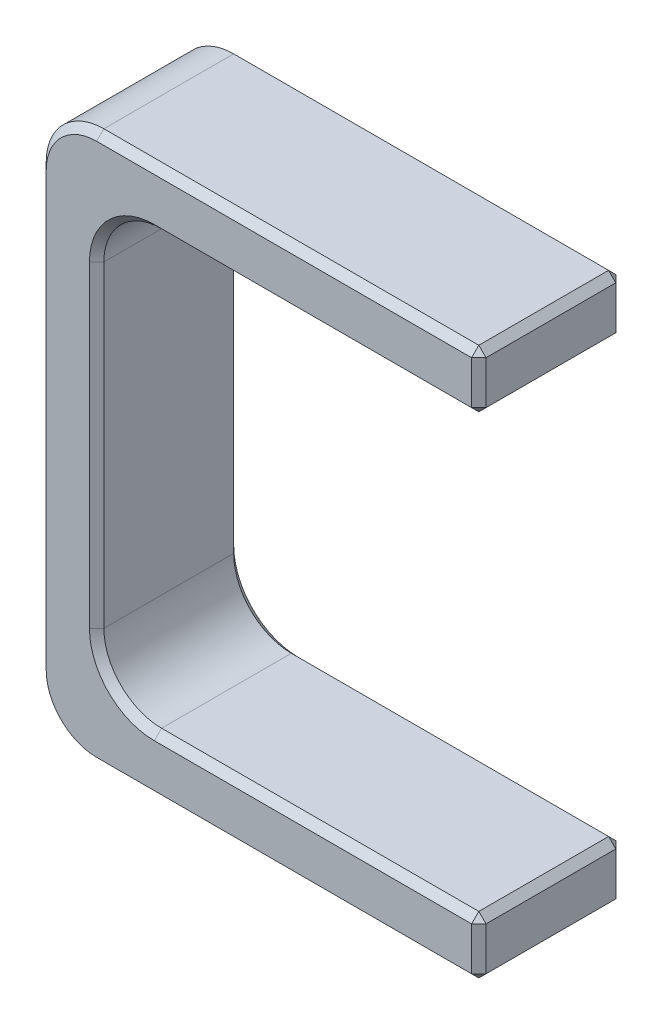
from build123d import *

# Parameters (mm, degrees)
BOSS_EXTRUDE1_DEPTH = 10
FILLET1_R           = 4
CHAMFER1_SIZE       = 0.5


with BuildPart() as part:
    # Sketch1 → Boss-Extrude1 (new body)
    with BuildSketch(Plane.XY):
        Polygon((0, 0), (0, 38), (30.5, 38), (30.5, 34), (4, 34), (4, 4), (30.5, 4), (30.5, 0), align=None)
    extrude(amount=BOSS_EXTRUDE1_DEPTH)

    # Fillet1
    fillet1_edges = [part.edges().sort_by_distance(p)[0] for p in [
        (0, 0, 5),
        (0, 38, 5),
        (4, 34, 5),
        (4, 4, 5),
    ]]
    fillet(fillet1_edges, radius=FILLET1_R)

    # Chamfer1
    chamfer1_edges = [part.edges().sort_by_distance(p)[0] for p in [
        (19.25, 4, 10),
        (30.5, 2, 0),
        (30.5, 38, 5),
        (30.5, 34, 5),
        (30.5, 4, 5),
        (30.5, 0, 5),
        (30.5, 36, 10),
        (17.25, 38, 10),
        (4, 19, 0),
        (4, 19, 10),
        (19.25, 34, 0),
        (19.25, 34, 10),
        (0, 19, 0),
        (0, 19, 10),
        (17.25, 0, 0),
        (1.171572875, 1.171572875, 0),
        (1.171572875, 36.828427125, 0),
        (17.25, 0, 10),
        (1.171572875, 1.171572875, 10),
        (1.171572875, 36.828427125, 10),
        (5.171572875, 5.171572875, 0),
        (5.171572875, 5.171572875, 10),
        (5.171572875, 32.828427125, 0),
        (5.171572875, 32.828427125, 10),
        (30.5, 2, 10),
        (17.25, 38, 0),
        (30.5, 36, 0),
        (19.25, 4, 0),
    ]]
    chamfer(chamfer1_edges, length=CHAMFER1_SIZE)


solid = part.part
